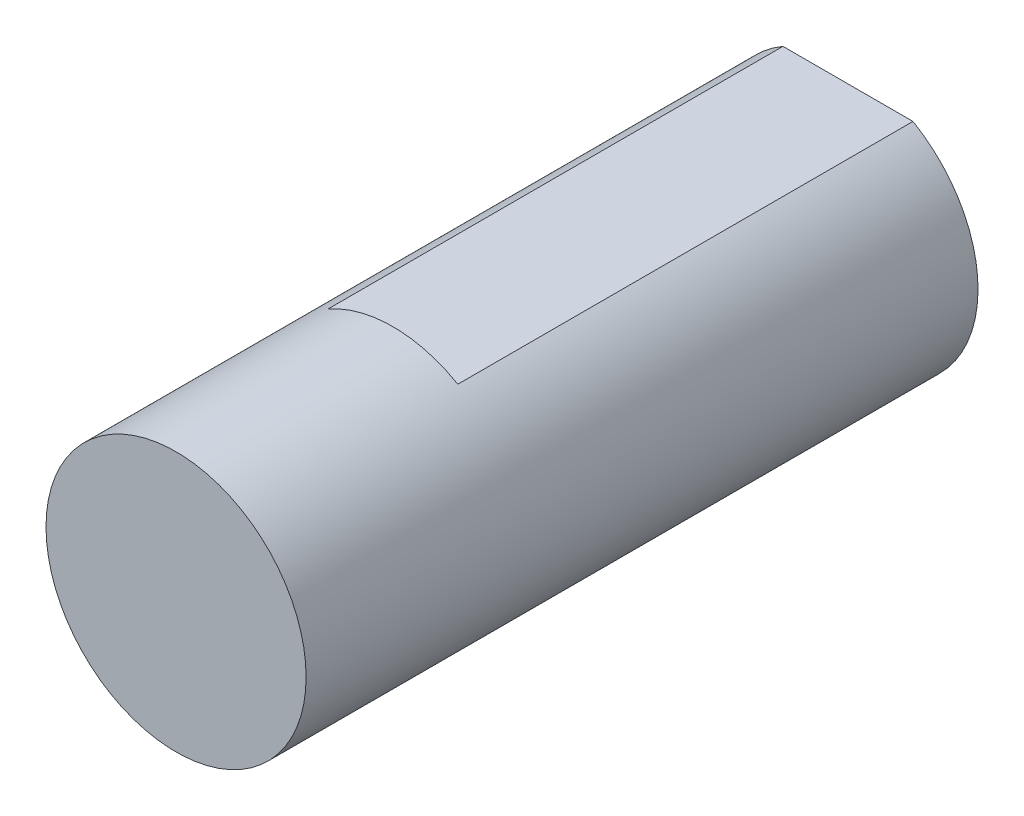
from build123d import *

# Parameters (mm, degrees)
SKETCH1_R           = 6
BOSS_EXTRUDE1_DEPTH = 31
CUT_EXTRUDE1_DEPTH  = 21


with BuildPart() as part:
    # Sketch1 → Boss-Extrude1 (new body)
    with BuildSketch(Plane.XY):
        Circle(SKETCH1_R)
    extrude(amount=BOSS_EXTRUDE1_DEPTH)

    # Sketch2 → Cut-Extrude1 (cut)
    with BuildSketch(Plane(origin=(0, 0, 0), x_dir=(-1, 0, 0), z_dir=(0, 0, -1))):
        Polygon((-41.730042052, 5.196152423), (-3, 5.196152423), (3, 5.196152423), (41.730042052, 5.196152423), (41.730042052, 82.656236526), (-41.730042052, 82.656236526), align=None)
    extrude(amount=-CUT_EXTRUDE1_DEPTH, mode=Mode.SUBTRACT)


solid = part.part
